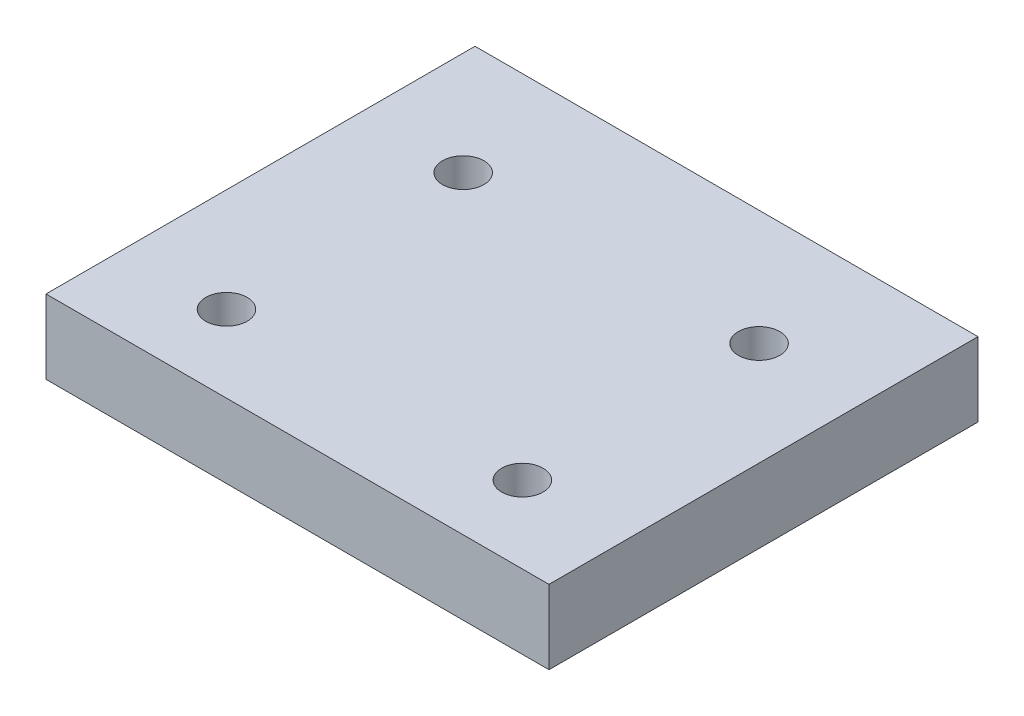
from build123d import *

# Parameters (mm, degrees)
SKETCH1_W           = 34
SKETCH1_H           = 29
SKETCH1_R           = 1.4
BOSS_EXTRUDE1_DEPTH = 5


with BuildPart() as part:
    # Sketch1 → Boss-Extrude1 (new body)
    with BuildSketch(Plane(origin=(0, 0, 0), x_dir=(1, 0, 0), z_dir=(0, 1, 0))):
        Rectangle(SKETCH1_W, SKETCH1_H)
        with Locations(Location((-10, -9.3, 0), (0, 0, 270))):
            Circle(SKETCH1_R, mode=Mode.SUBTRACT)
        with Locations(Location((10, -9.3, 0), (0, 0, 270))):
            Circle(SKETCH1_R, mode=Mode.SUBTRACT)
        with Locations(Location((10, 6.7, 0), (0, 0, 270))):
            Circle(SKETCH1_R, mode=Mode.SUBTRACT)
        with Locations(Location((-10, 6.7, 0), (0, 0, 270))):
            Circle(SKETCH1_R, mode=Mode.SUBTRACT)
    extrude(amount=BOSS_EXTRUDE1_DEPTH)


solid = part.part
